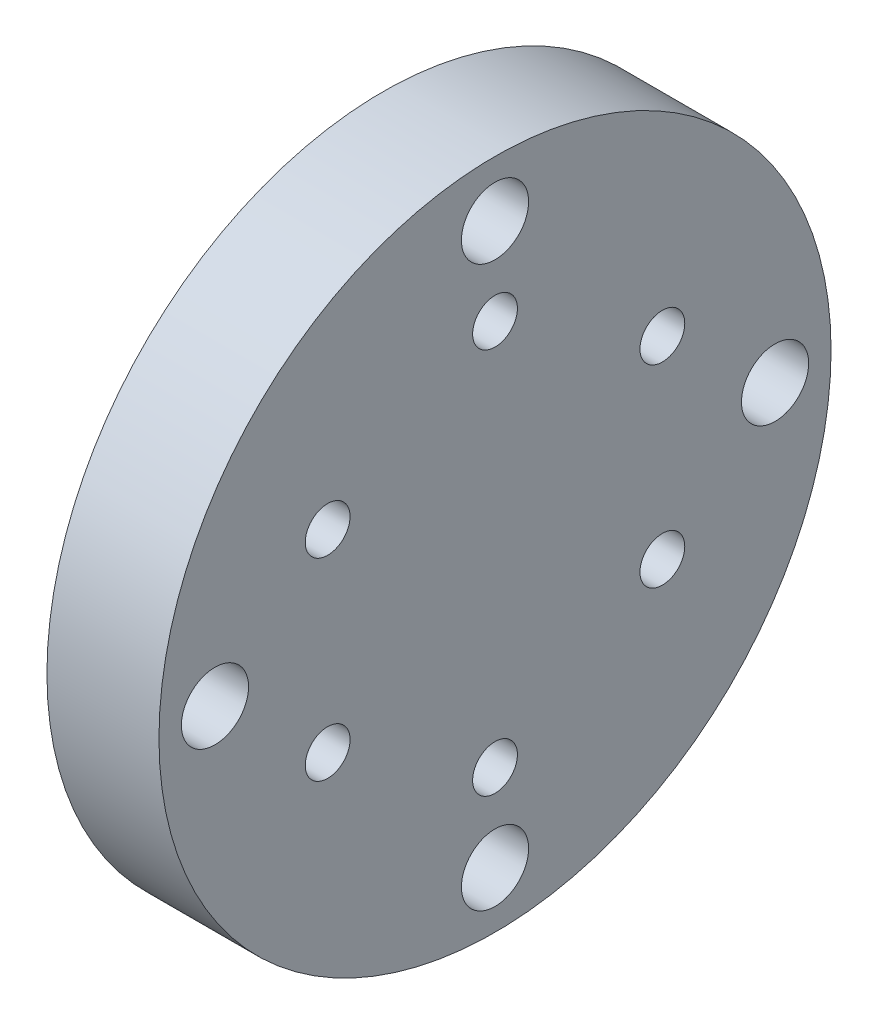
from build123d import *

# Parameters (mm, degrees)
SKETCH_1_R      = 30
SKETCH_1_R_2    = 2
SKETCH_1_R_3    = 3
EXTRUDE_1_DEPTH = 10


with BuildPart() as part:
    # 草图1 → 凸台-拉伸1 (new body)
    with BuildSketch(Plane(origin=(0, 0, 0), x_dir=(0, 0, -1), z_dir=(1, 0, 0))):
        with Locations((-12.848392551, 0.04812132)):
            Circle(SKETCH_1_R)
        with Locations((-12.848392551, 17.29812132)):
            Circle(SKETCH_1_R_2, mode=Mode.SUBTRACT)
        with Locations((2.090545664, 8.67312132)):
            Circle(SKETCH_1_R_2, mode=Mode.SUBTRACT)
        with Locations((2.090545664, -8.57687868)):
            Circle(SKETCH_1_R_2, mode=Mode.SUBTRACT)
        with Locations((-12.848392551, -17.20187868)):
            Circle(SKETCH_1_R_2, mode=Mode.SUBTRACT)
        with Locations((-27.787330766, -8.57687868)):
            Circle(SKETCH_1_R_2, mode=Mode.SUBTRACT)
        with Locations((-27.787330766, 8.67312132)):
            Circle(SKETCH_1_R_2, mode=Mode.SUBTRACT)
        with Locations((-12.848392551, 25.04812132)):
            Circle(SKETCH_1_R_3, mode=Mode.SUBTRACT)
        with Locations((12.151607449, 0.04812132)):
            Circle(SKETCH_1_R_3, mode=Mode.SUBTRACT)
        with Locations((-12.848392551, -24.95187868)):
            Circle(SKETCH_1_R_3, mode=Mode.SUBTRACT)
        with Locations((-37.848392551, 0.04812132)):
            Circle(SKETCH_1_R_3, mode=Mode.SUBTRACT)
    extrude(amount=EXTRUDE_1_DEPTH)


solid = part.part
